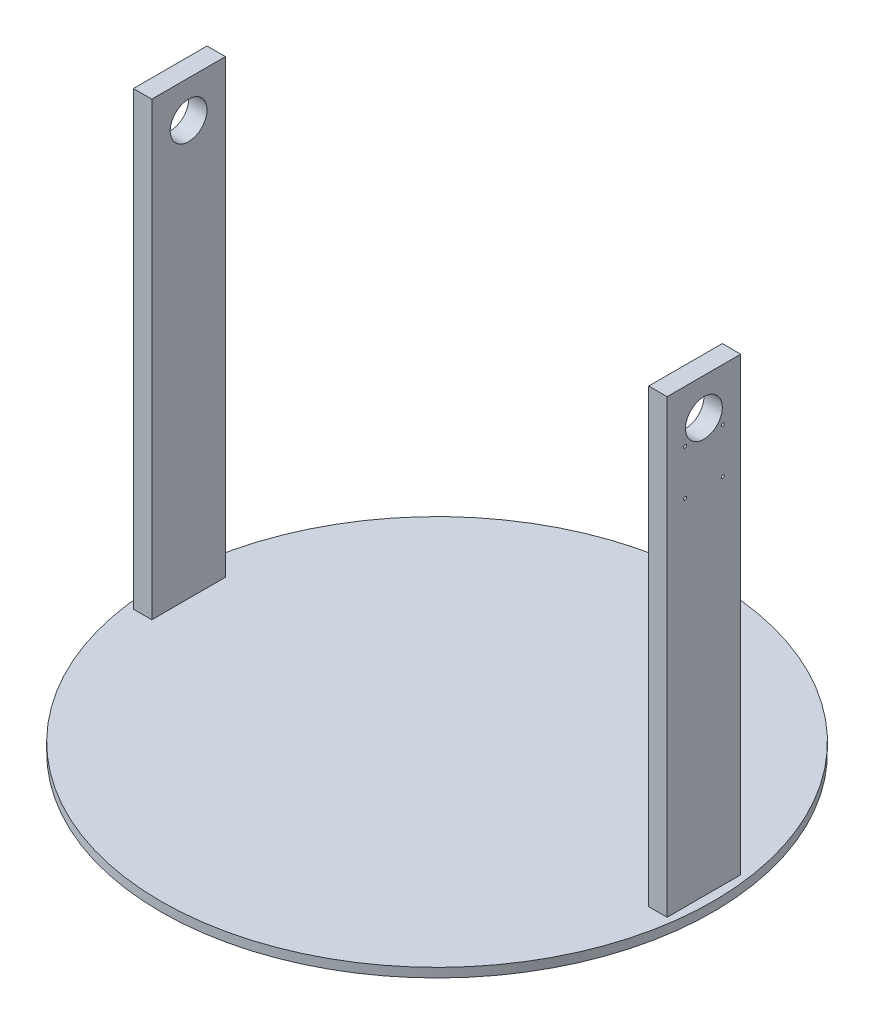
from build123d import *

# Parameters (mm, degrees)
SZKIC1_W                      = 10
SZKIC1_H                      = 40
DODANIE_WYCI_GNI_CIE1_DEPTH   = 250
DODANIE_WYCI_GNI_CIE1_2_DEPTH = 250
SZKIC1_3_R                    = 150
DODANIE_WYCI_GNI_CIE2_DEPTH   = 5
SZKIC2_R                      = 10
WYTNIJ_WYCI_GNI_CIE1_DEPTH    = 290
SZKIC3_R                      = 0.8
WYTNIJ_WYCI_GNI_CIE4_DEPTH    = 10


with BuildPart() as part:
    # Szkic1 → Dodanie-wyciągnięcie1 (new body)
    with BuildSketch(Plane(origin=(0, 0, 0), x_dir=(1, 0, 0), z_dir=(0, 1, 0))):
        with Locations((140, 0)):
            Rectangle(SZKIC1_W, SZKIC1_H)
    extrude(amount=DODANIE_WYCI_GNI_CIE1_DEPTH)



with BuildPart() as body_2:
    # Szkic1 → Dodanie-wyci_gni_cie1 2 (new body)
    with BuildSketch(Plane(origin=(0, 0, 0), x_dir=(1, 0, 0), z_dir=(0, 1, 0))):
        with Locations((-140, 0)):
            Rectangle(SZKIC1_W, SZKIC1_H)
    extrude(amount=DODANIE_WYCI_GNI_CIE1_2_DEPTH)


with BuildPart() as part_1:
    add(part.part)

    add(body_2.part)  # Dodanie-wyciągnięcie2 merges body 2
    # Szkic1<3> → Dodanie-wyciągnięcie2 (add)
    with BuildSketch(Plane(origin=(0, 0, 0), x_dir=(1, 0, 0), z_dir=(0, 1, 0))):
        Circle(SZKIC1_3_R)
        Polygon((-135, 20), (-135, 0), (-135, -20), (-140, -20), (-145, -20), (-145, 20), (-140, 20), align=None, mode=Mode.SUBTRACT)
        Polygon((135, -20), (135, 0), (135, 20), (140, 20), (145, 20), (145, -20), (140, -20), align=None, mode=Mode.SUBTRACT)
    extrude(amount=DODANIE_WYCI_GNI_CIE2_DEPTH)

    # Szkic2 → Wytnij-wyciągnięcie1 (cut)
    with BuildSketch(Plane(origin=(145, 0, 0), x_dir=(0, 0, -1), z_dir=(1, 0, 0))):
        with Locations((0, 230)):
            Circle(SZKIC2_R)
    extrude(amount=-WYTNIJ_WYCI_GNI_CIE1_DEPTH, mode=Mode.SUBTRACT)

    # Szkic3 → Wytnij-wyciągnięcie4 (cut)
    with BuildSketch(Plane(origin=(145, 0, 0), x_dir=(0, 0, -1), z_dir=(1, 0, 0))):
        with Locations((-10.25, 221.7)):
            Circle(SZKIC3_R)
        with Locations((10.25, 197.25)):
            Circle(SZKIC3_R)
        with Locations((10.25, 221.7)):
            Circle(SZKIC3_R)
        with Locations((-10.25, 197.25)):
            Circle(SZKIC3_R)
    extrude(amount=-WYTNIJ_WYCI_GNI_CIE4_DEPTH, mode=Mode.SUBTRACT)


solid = part_1.part
